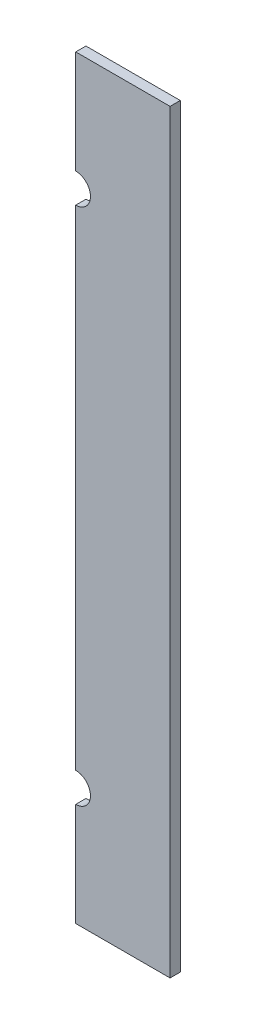
from build123d import *

# Parameters (mm, degrees)
SKETCH1_W               = 25.4
SKETCH1_H               = 2.7432
BOSS_EXTRUDE1_DEPTH     = 203.2
CUT_EXTRUDE1_DEPTH      = 111.720339735
CUT_EXTRUDE1_DEPTH_BACK = 111.720339735
SKETCH2_R               = 3.96875


with BuildPart() as part:
    # Sketch1 → Boss-Extrude1 (new body)
    with BuildSketch(Plane(origin=(0, 0, 0), x_dir=(1, 0, 0), z_dir=(0, 1, 0))):
        with Locations((12.7, -1.3716)):
            Rectangle(SKETCH1_W, SKETCH1_H)
    extrude(amount=BOSS_EXTRUDE1_DEPTH)

    # Sketch2 → Cut-Extrude1 (cut, two sides: drawn at the far end of the back side and taken through both)
    with BuildSketch(Plane(origin=(-3.908296933, 106.606717755, 5.9182), x_dir=(1, 0, 0), z_dir=(0, 0, 1)).offset(-CUT_EXTRUDE1_DEPTH_BACK)):
        with Locations((3.908296933, 64.843282245)):
            Circle(SKETCH2_R)
        with Locations((3.908296933, -74.856717755)):
            Circle(SKETCH2_R)
    extrude(amount=CUT_EXTRUDE1_DEPTH + CUT_EXTRUDE1_DEPTH_BACK, mode=Mode.SUBTRACT)


solid = part.part
